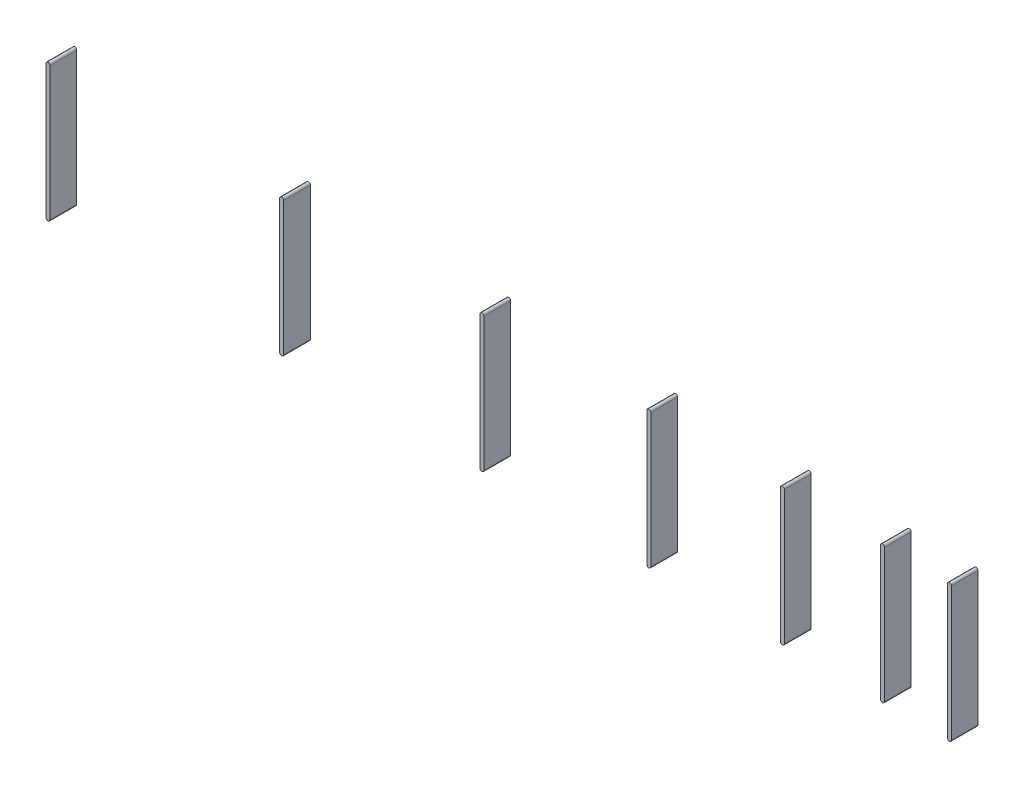
from build123d import *

# Parameters (mm, degrees)
BOSS_EXTRUDE1_DEPTH   = 4
BOSS_EXTRUDE1_2_DEPTH = 4
BOSS_EXTRUDE1_3_DEPTH = 4
BOSS_EXTRUDE1_4_DEPTH = 4
BOSS_EXTRUDE1_5_DEPTH = 4
BOSS_EXTRUDE1_6_DEPTH = 4
BOSS_EXTRUDE1_7_DEPTH = 4


with BuildPart() as part:
    # Sketch1 → Boss-Extrude1 (new body)
    with BuildSketch(Plane.XY):
        with BuildLine():
            Line((0.3, 0), (0.3, -20))
            ThreePointArc((0.3, -20), (0, -20.3), (-0.3, -20))
            Line((-0.3, -20), (-0.3, 0))
            ThreePointArc((-0.3, 0), (0, 0.3), (0.3, 0))
        make_face()
    extrude(amount=BOSS_EXTRUDE1_DEPTH)


with BuildPart() as body_2:
    # Sketch1 → Boss-Extrude1 2 (new body)
    with BuildSketch(Plane.XY):
        with BuildLine():
            Line((25.3, 0), (25.3, -20))
            ThreePointArc((25.3, -20), (25, -20.3), (24.7, -20))
            Line((24.7, -20), (24.7, 0))
            ThreePointArc((24.7, 0), (25, 0.3), (25.3, 0))
        make_face()
    extrude(amount=BOSS_EXTRUDE1_2_DEPTH)


with BuildPart() as body_3:
    # Sketch1 → Boss-Extrude1 3 (new body)
    with BuildSketch(Plane.XY):
        with BuildLine():
            Line((15.3, 0), (15.3, -20))
            ThreePointArc((15.3, -20), (15, -20.3), (14.7, -20))
            Line((14.7, -20), (14.7, 0))
            ThreePointArc((14.7, 0), (15, 0.3), (15.3, 0))
        make_face()
    extrude(amount=BOSS_EXTRUDE1_3_DEPTH)


with BuildPart() as body_4:
    # Sketch1 → Boss-Extrude1 4 (new body)
    with BuildSketch(Plane.XY):
        with BuildLine():
            Line((-19.7, 0), (-19.7, -20))
            ThreePointArc((-19.7, -20), (-20, -20.3), (-20.3, -20))
            Line((-20.3, -20), (-20.3, 0))
            ThreePointArc((-20.3, 0), (-20, 0.3), (-19.7, 0))
        make_face()
    extrude(amount=BOSS_EXTRUDE1_4_DEPTH)


with BuildPart() as body_5:
    # Sketch1 → Boss-Extrude1 5 (new body)
    with BuildSketch(Plane.XY):
        with BuildLine():
            Line((-44.7, 0), (-44.7, -20))
            ThreePointArc((-44.7, -20), (-45, -20.3), (-45.3, -20))
            Line((-45.3, -20), (-45.3, 0))
            ThreePointArc((-45.3, 0), (-45, 0.3), (-44.7, 0))
        make_face()
    extrude(amount=BOSS_EXTRUDE1_5_DEPTH)


with BuildPart() as body_6:
    # Sketch1 → Boss-Extrude1 6 (new body)
    with BuildSketch(Plane.XY):
        with BuildLine():
            Line((-74.7, 0), (-74.7, -20))
            ThreePointArc((-74.7, -20), (-75, -20.3), (-75.3, -20))
            Line((-75.3, -20), (-75.3, 0))
            ThreePointArc((-75.3, 0), (-75, 0.3), (-74.7, 0))
        make_face()
    extrude(amount=BOSS_EXTRUDE1_6_DEPTH)


with BuildPart() as body_7:
    # Sketch1 → Boss-Extrude1 7 (new body)
    with BuildSketch(Plane.XY):
        with BuildLine():
            Line((-109.7, 0), (-109.7, -20))
            ThreePointArc((-109.7, -20), (-110, -20.3), (-110.3, -20))
            Line((-110.3, -20), (-110.3, 0))
            ThreePointArc((-110.3, 0), (-110, 0.3), (-109.7, 0))
        make_face()
    extrude(amount=BOSS_EXTRUDE1_7_DEPTH)


solid = Compound([part.part, body_2.part, body_3.part, body_4.part, body_5.part, body_6.part, body_7.part])
